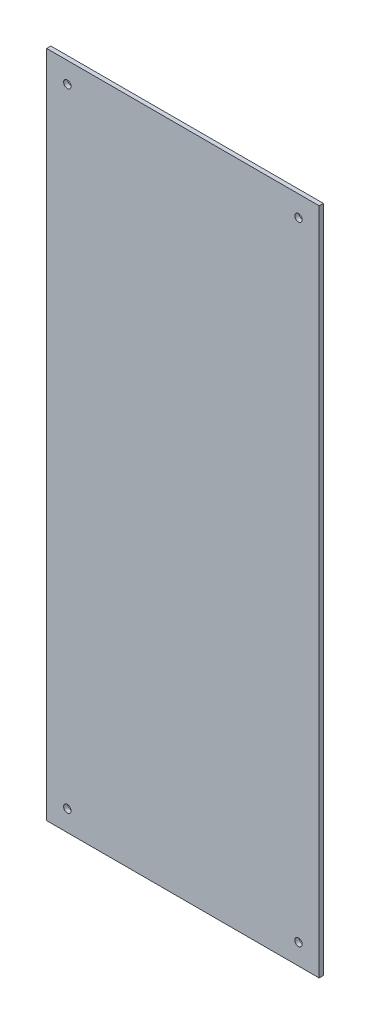
from build123d import *

# Parameters (mm, degrees)
SKETCH1_W           = 500
SKETCH1_H           = 200
SKETCH1_R           = 2.8
BOSS_EXTRUDE1_DEPTH = 3.175
SKETCH2_W           = 206.35
SKETCH2_H           = 506.35
SKETCH2_W_2         = 200
SKETCH2_H_2         = 500
BOSS_EXTRUDE2_DEPTH = 3.175


with BuildPart() as part:
    # Sketch1 → Boss-Extrude1 (new body)
    with BuildSketch(Plane(origin=(0, 0, 0), x_dir=(0, 1, 0), z_dir=(0, 0, 1))):
        Rectangle(SKETCH1_W, SKETCH1_H)
        with Locations(Location((-237.5, 87.5, 0), (0, 0, 270))):
            Circle(SKETCH1_R, mode=Mode.SUBTRACT)
        with Locations(Location((237.5, 87.5, 0), (0, 0, 270))):
            Circle(SKETCH1_R, mode=Mode.SUBTRACT)
        with Locations(Location((237.5, -87.5, 0), (0, 0, 270))):
            Circle(SKETCH1_R, mode=Mode.SUBTRACT)
        with Locations(Location((-237.5, -87.5, 0), (0, 0, 270))):
            Circle(SKETCH1_R, mode=Mode.SUBTRACT)
    extrude(amount=BOSS_EXTRUDE1_DEPTH)

    # Sketch2 → Boss-Extrude2 (add, through all)
    with BuildSketch(Plane.XY.offset(3.175)):
        Rectangle(SKETCH2_W, SKETCH2_H)
        Rectangle(SKETCH2_W_2, SKETCH2_H_2, mode=Mode.SUBTRACT)
    extrude(amount=-BOSS_EXTRUDE2_DEPTH)


solid = part.part
